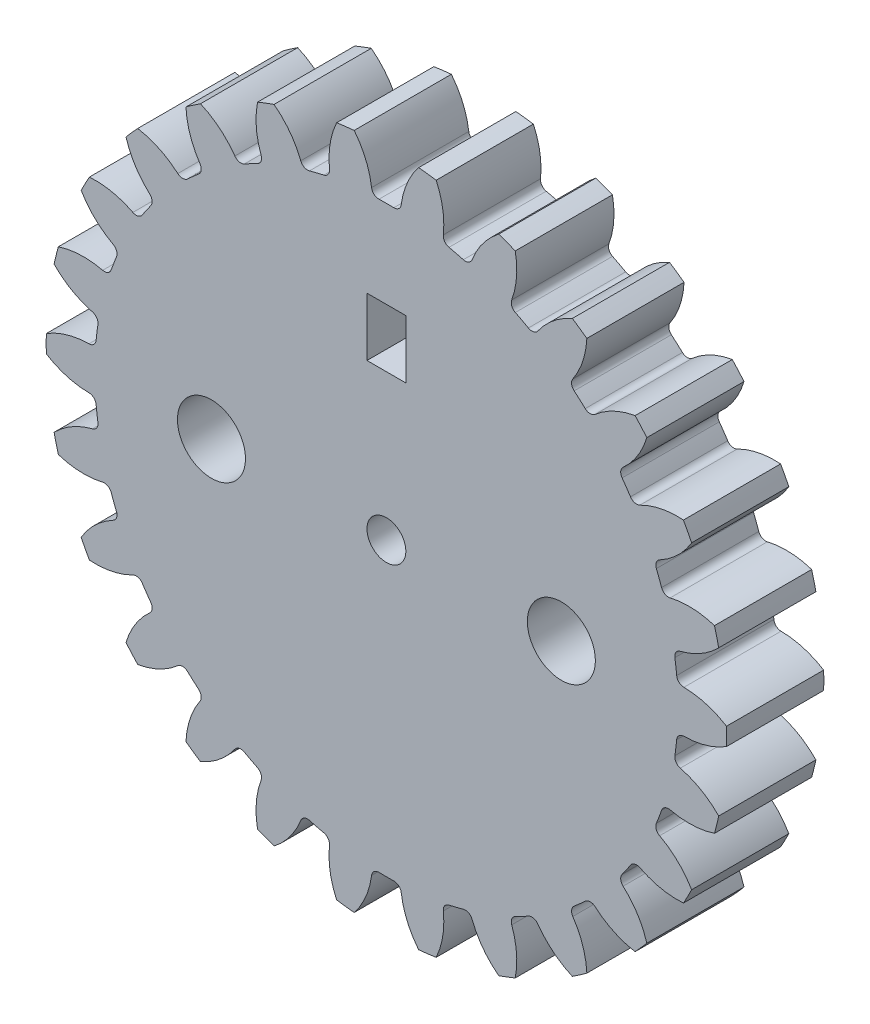
from build123d import *

# Parameters (mm, degrees)
SKETCH1_R                   = 17.5
BOSS_EXTRUDE1_DEPTH         = 2.5
CUT_EXTRUDE1_DEPTH          = 25.874685928
FILLET2_R                   = 0.375
CIRPATTERN1_COUNT           = 26
FILLET2_OF_CIRPATTERN1_R    = 0.375
STRING_HOLE_DEPTH           = 25.819388405
STRING_HOLE_DEPTH_BACK      = 25.819388405
SKETCH4_R                   = 1
TO_KNUCKLE_MOUNT_DEPTH      = 25.819388405
TO_KNUCKLE_MOUNT_DEPTH_BACK = 25.819388405
SKETCH5_R                   = 1.75
SKETCH6_W                   = 2
SKETCH6_H                   = 3
FOR_ALIGNMENT_DEPTH         = 2


with BuildPart() as part:
    # Sketch1 → Boss-Extrude1 (new, symmetric)
    with BuildSketch(Plane.XY):
        Circle(SKETCH1_R)
    extrude(amount=BOSS_EXTRUDE1_DEPTH, both=True)

    # Sketch3 → Cut-Extrude1 (cut, symmetric)
    with BuildSketch(Plane.XY):
        with BuildLine():
            ThreePointArc((-0.731537344, 14.982151151), (0, 15), (0.731537344, 14.982151151))
            ThreePointArc((0.731537344, 14.982151151), (1.001492244, 16.275061461), (1.657699213, 17.421309748))
            ThreePointArc((1.657699213, 17.421309748), (0, 17.5), (-1.657699213, 17.421309748))
            ThreePointArc((-1.657699213, 17.421309748), (-1.001492244, 16.275061461), (-0.731537344, 14.982151151))
        make_face()
    cut_extrude1 = extrude(amount=CUT_EXTRUDE1_DEPTH, both=True, mode=Mode.SUBTRACT)

    # Fillet2
    fillet2_edges = [part.edges().sort_by_distance(p)[0] for p in [
        (0.731537344, 14.982151151, 0),
        (-0.731537344, 14.982151151, 0),
    ]]
    fillet(fillet2_edges, radius=FILLET2_R)

    # CirPattern1: Cut-Extrude1 ×26 about axis
    cirpattern1_axis = Axis((0, 0, 0), (0, 0, 1))
    for i in range(1, CIRPATTERN1_COUNT):
        add(cut_extrude1.rotate(cirpattern1_axis, i * 360 / CIRPATTERN1_COUNT), mode=Mode.SUBTRACT)

    # Fillet2 of CirPattern1
    fillet2_of_cirpattern1_edges = [part.edges().sort_by_distance(p)[0] for p in [
        (-2.875183257, 14.721865413, 0),
        (-4.295743653, 14.371728722, 0),
        (-6.314808658, 13.605998369, 0),
        (-7.610296956, 12.926073659, 0),
        (-9.387440333, 11.699400155, 0),
        (-10.482567462, 10.729202179, 0),
        (-11.914508098, 9.11287533, 0),
        (-12.74562925, 7.908788468, 0),
        (-13.74914796, 5.996743315, 0),
        (-14.267961394, 4.628744718, 0),
        (-14.784737318, 2.532102376, 0),
        (-14.961091484, 1.07969515, 0),
        (-14.961091484, -1.07969515, 0),
        (-14.784737318, -2.532102376, 0),
        (-14.267961394, -4.628744718, 0),
        (-13.74914796, -5.996743315, 0),
        (-12.74562925, -7.908788468, 0),
        (-11.914508098, -9.11287533, 0),
        (-10.482567462, -10.729202179, 0),
        (-9.387440333, -11.699400155, 0),
        (-7.610296956, -12.926073659, 0),
        (-6.314808658, -13.605998369, 0),
        (-4.295743653, -14.371728722, 0),
        (-2.875183257, -14.721865413, 0),
        (-0.731537344, -14.982151151, 0),
        (0.731537344, -14.982151151, 0),
        (2.875183257, -14.721865413, 0),
        (4.295743653, -14.371728722, 0),
        (6.314808658, -13.605998369, 0),
        (7.610296956, -12.926073659, 0),
        (9.387440333, -11.699400155, 0),
        (10.482567462, -10.729202179, 0),
        (11.914508098, -9.11287533, 0),
        (12.74562925, -7.908788468, 0),
        (13.74914796, -5.996743315, 0),
        (14.267961394, -4.628744718, 0),
        (14.784737318, -2.532102376, 0),
        (14.961091484, -1.07969515, 0),
        (14.961091484, 1.07969515, 0),
        (14.784737318, 2.532102376, 0),
        (14.267961394, 4.628744718, 0),
        (13.74914796, 5.996743315, 0),
        (12.74562925, 7.908788468, 0),
        (11.914508098, 9.11287533, 0),
        (10.482567462, 10.729202179, 0),
        (9.387440333, 11.699400155, 0),
        (7.610296956, 12.926073659, 0),
        (6.314808658, 13.605998369, 0),
        (4.295743653, 14.371728722, 0),
        (2.875183257, 14.721865413, 0),
    ]]
    fillet(fillet2_of_cirpattern1_edges, radius=FILLET2_OF_CIRPATTERN1_R)

    # Sketch4 → String_Hole (cut, two sides: drawn at the far end of the back side and taken through both)
    with BuildSketch(Plane.XY.offset(-STRING_HOLE_DEPTH_BACK)):
        Circle(SKETCH4_R)
    extrude(amount=STRING_HOLE_DEPTH + STRING_HOLE_DEPTH_BACK, mode=Mode.SUBTRACT)

    # Sketch5 → To_Knuckle_Mount (cut, two sides: drawn at the far end of the back side and taken through both)
    with BuildSketch(Plane.XY.offset(-TO_KNUCKLE_MOUNT_DEPTH_BACK)):
        with Locations((9, 0)):
            Circle(SKETCH5_R)
        with Locations((-9, 0)):
            Circle(SKETCH5_R)
    extrude(amount=TO_KNUCKLE_MOUNT_DEPTH + TO_KNUCKLE_MOUNT_DEPTH_BACK, mode=Mode.SUBTRACT)

    # Sketch6 → For_Alignment (cut)
    with BuildSketch(Plane.XY.offset(2.5)):
        with Locations((0, 9)):
            Rectangle(SKETCH6_W, SKETCH6_H)
    extrude(amount=-FOR_ALIGNMENT_DEPTH, mode=Mode.SUBTRACT)


solid = part.part
